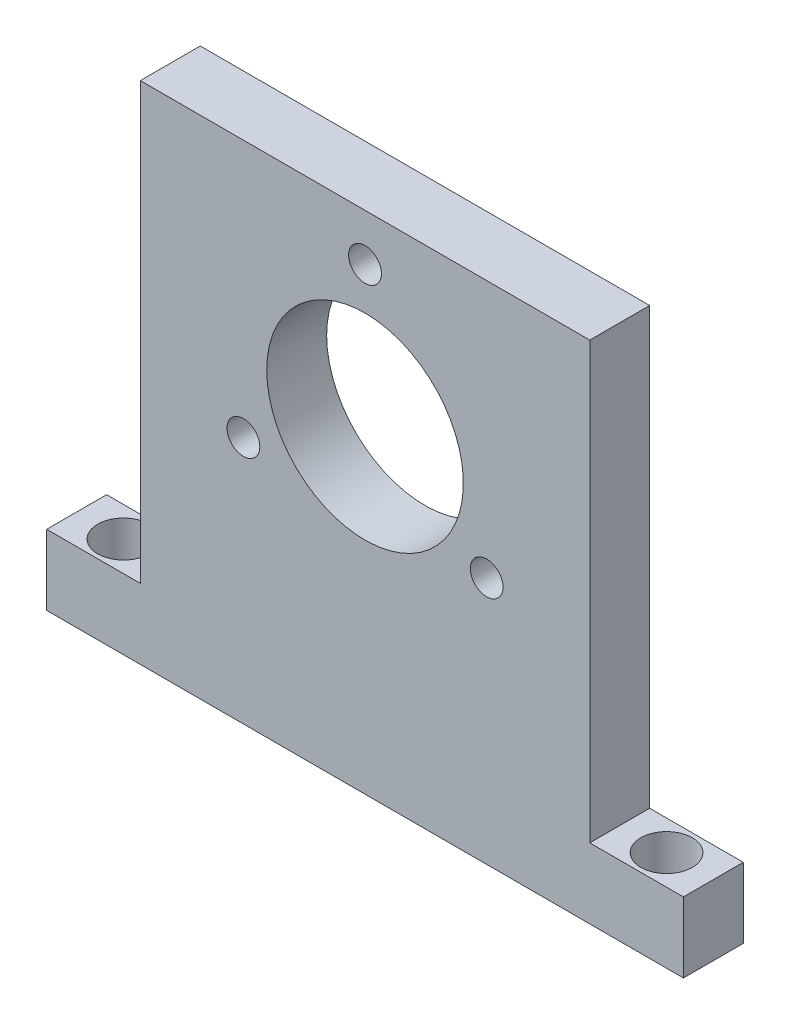
from build123d import *

# Parameters (mm, degrees)
SKETCH2_R                  = 4.175
BOSS_EXTRUDE1_DEPTH        = 6.4
SKETCH3_R                  = 10.5
CUT_EXTRUDE1_DEPTH         = 65.132363125
F_3_5_3_5_DIAMETER_HOLE1_D = 3.5
CIRPATTERN1_COUNT          = 3
CUT_EXTRUDE2_DEPTH         = 58.958692187
CUT_EXTRUDE2_DEPTH_BACK    = 58.958692187
SKETCH12_R                 = 2.75


with BuildPart() as part:
    # Sketch2 → Boss-Extrude1 (new body)
    with BuildSketch(Plane.XY):
        Polygon((-34, 0), (34, 0), (34, 7.5), (24, 7.5), (24, 54), (-24, 54), (-24, 7.5), (-34, 7.5), align=None)
        with Locations((0, 34)):
            Circle(SKETCH2_R, mode=Mode.SUBTRACT)
    extrude(amount=-BOSS_EXTRUDE1_DEPTH)

    # Sketch3 → Cut-Extrude1 (cut, through all)
    with BuildSketch(Plane(origin=(0, 0, -6.4), x_dir=(-1, 0, 0), z_dir=(0, 0, -1))):
        with Locations((0, 34)):
            Circle(SKETCH3_R)
    extrude(amount=-CUT_EXTRUDE1_DEPTH, mode=Mode.SUBTRACT)

    # Ø3.5 (3.5) Diameter Hole1 (through all)
    with Locations(Plane.XY):
        with Locations((0, 49)):
            f_3_5_3_5_diameter_hole1 = Hole(F_3_5_3_5_DIAMETER_HOLE1_D / 2)

    # CirPattern1: Ø3.5 (3.5) Diameter Hole1 ×3 about axis
    cirpattern1_axis = Axis((0, 34, 0), (0, 0, 1))
    for i in range(1, CIRPATTERN1_COUNT):
        add(f_3_5_3_5_diameter_hole1.rotate(cirpattern1_axis, i * 360 / CIRPATTERN1_COUNT), mode=Mode.SUBTRACT)

    # Sketch12 → Cut-Extrude2 (cut, two sides: drawn at the far end of the back side and taken through both)
    with BuildSketch(Plane(origin=(0, 7.5, 0), x_dir=(1, 0, 0), z_dir=(0, 1, 0)).offset(-CUT_EXTRUDE2_DEPTH_BACK)):
        with Locations(Location((-29, 3.2, 0), (0, 0, 90))):
            Circle(SKETCH12_R)
        with Locations(Location((29, 3.2, 0), (0, 0, 90))):
            Circle(SKETCH12_R)
    extrude(amount=CUT_EXTRUDE2_DEPTH + CUT_EXTRUDE2_DEPTH_BACK, mode=Mode.SUBTRACT)


solid = part.part
